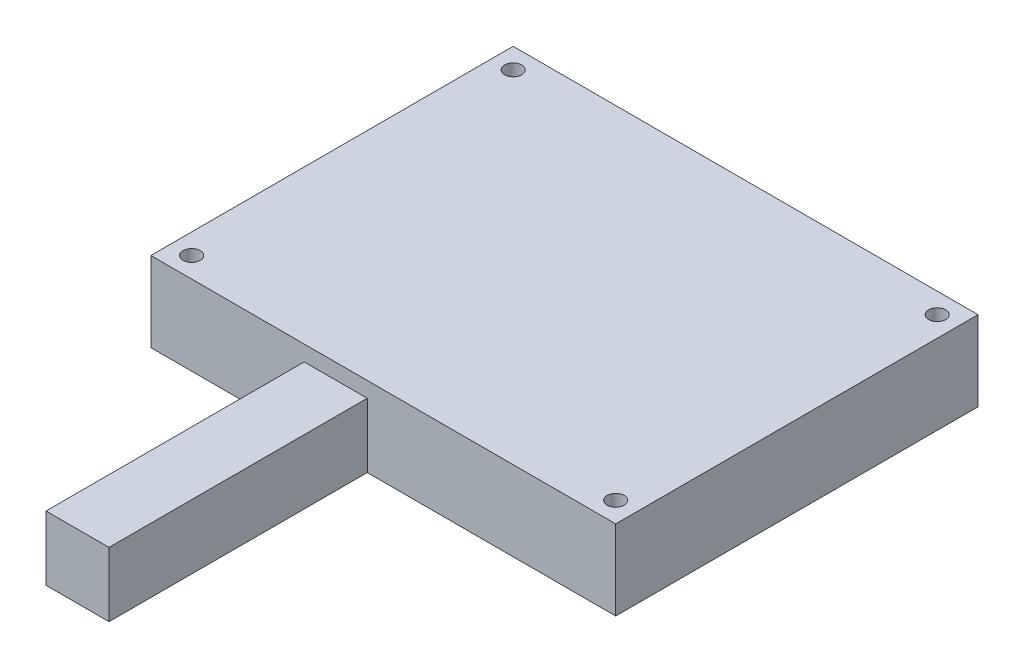
from build123d import *

# Parameters (mm, degrees)
SKETCH1_W           = 90
SKETCH1_H           = 70.15
SKETCH1_R           = 1.65
BOSS_EXTRUDE1_DEPTH = 15.45
SKETCH2_W           = 12.2
SKETCH2_H           = 12.46
BOSS_EXTRUDE2_DEPTH = 50


with BuildPart() as part:
    # Sketch1 → Boss-Extrude1 (new body)
    with BuildSketch(Plane(origin=(0, 0, 0), x_dir=(1, 0, 0), z_dir=(0, 1, 0))):
        Rectangle(SKETCH1_W, SKETCH1_H)
        with Locations(Location((-41.05, 31.125, 0), (0, 0, 270))):
            Circle(SKETCH1_R, mode=Mode.SUBTRACT)
        with Locations(Location((41.05, 31.125, 0), (0, 0, 270))):
            Circle(SKETCH1_R, mode=Mode.SUBTRACT)
        with Locations(Location((-41.05, -31.125, 0), (0, 0, 270))):
            Circle(SKETCH1_R, mode=Mode.SUBTRACT)
        with Locations(Location((41.05, -31.125, 0), (0, 0, 270))):
            Circle(SKETCH1_R, mode=Mode.SUBTRACT)
    extrude(amount=BOSS_EXTRUDE1_DEPTH)

    # Sketch2 → Boss-Extrude2 (add)
    with BuildSketch(Plane.XY.offset(35.075)):
        with Locations((-9.2, 6.23)):
            Rectangle(SKETCH2_W, SKETCH2_H)
    extrude(amount=BOSS_EXTRUDE2_DEPTH)


solid = part.part
